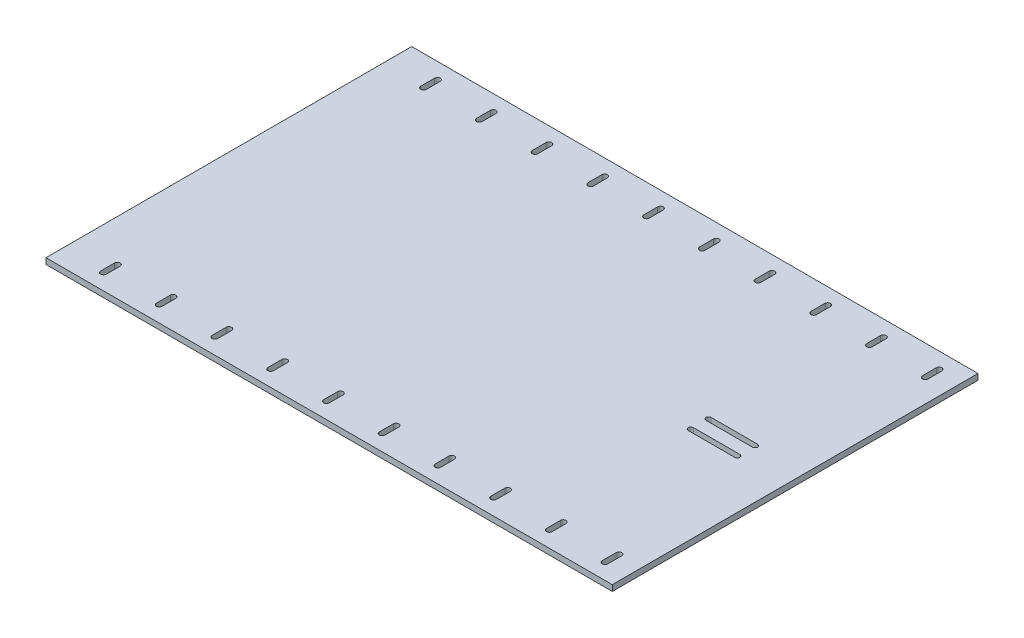
from build123d import *

# Parameters (mm, degrees)
SKETCH1_W           = 609.6
SKETCH1_H           = 393.7
BOSS_EXTRUDE1_DEPTH = 6.35


with BuildPart() as part:
    # Sketch1 → Boss-Extrude1 (new body)
    with BuildSketch(Plane(origin=(0, 0, 0), x_dir=(1, 0, 0), z_dir=(0, 1, 0))):
        with Locations((304.8, 196.85)):
            Rectangle(SKETCH1_W, SKETCH1_H)
        with BuildLine():
            Line((587.8, 32.05), (587.8, 17.05))
            ThreePointArc((587.8, 17.05), (584.8, 14.05), (581.8, 17.05))
            Line((581.8, 17.05), (581.8, 32.05))
            ThreePointArc((581.8, 32.05), (584.8, 35.05), (587.8, 32.05))
        make_face(mode=Mode.SUBTRACT)
        with BuildLine():
            Line((527.8, 32.05), (527.8, 17.05))
            ThreePointArc((527.8, 17.05), (524.8, 14.05), (521.8, 17.05))
            Line((521.8, 17.05), (521.8, 32.05))
            ThreePointArc((521.8, 32.05), (524.8, 35.05), (527.8, 32.05))
        make_face(mode=Mode.SUBTRACT)
        with BuildLine():
            Line((467.8, 32.05), (467.8, 17.05))
            ThreePointArc((467.8, 17.05), (464.8, 14.05), (461.8, 17.05))
            Line((461.8, 17.05), (461.8, 32.05))
            ThreePointArc((461.8, 32.05), (464.8, 35.05), (467.8, 32.05))
        make_face(mode=Mode.SUBTRACT)
        with BuildLine():
            Line((407.8, 32.05), (407.8, 17.05))
            ThreePointArc((407.8, 17.05), (404.8, 14.05), (401.8, 17.05))
            Line((401.8, 17.05), (401.8, 32.05))
            ThreePointArc((401.8, 32.05), (404.8, 35.05), (407.8, 32.05))
        make_face(mode=Mode.SUBTRACT)
        with BuildLine():
            Line((347.8, 32.05), (347.8, 17.05))
            ThreePointArc((347.8, 17.05), (344.8, 14.05), (341.8, 17.05))
            Line((341.8, 17.05), (341.8, 32.05))
            ThreePointArc((341.8, 32.05), (344.8, 35.05), (347.8, 32.05))
        make_face(mode=Mode.SUBTRACT)
        with BuildLine():
            Line((287.8, 32.05), (287.8, 17.05))
            ThreePointArc((287.8, 17.05), (284.8, 14.05), (281.8, 17.05))
            Line((281.8, 17.05), (281.8, 32.05))
            ThreePointArc((281.8, 32.05), (284.8, 35.05), (287.8, 32.05))
        make_face(mode=Mode.SUBTRACT)
        with BuildLine():
            Line((227.8, 32.05), (227.8, 17.05))
            ThreePointArc((227.8, 17.05), (224.8, 14.05), (221.8, 17.05))
            Line((221.8, 17.05), (221.8, 32.05))
            ThreePointArc((221.8, 32.05), (224.8, 35.05), (227.8, 32.05))
        make_face(mode=Mode.SUBTRACT)
        with BuildLine():
            Line((167.8, 32.05), (167.8, 17.05))
            ThreePointArc((167.8, 17.05), (164.8, 14.05), (161.8, 17.05))
            Line((161.8, 17.05), (161.8, 32.05))
            ThreePointArc((161.8, 32.05), (164.8, 35.05), (167.8, 32.05))
        make_face(mode=Mode.SUBTRACT)
        with BuildLine():
            Line((107.8, 32.05), (107.8, 17.05))
            ThreePointArc((107.8, 17.05), (104.8, 14.05), (101.8, 17.05))
            Line((101.8, 17.05), (101.8, 32.05))
            ThreePointArc((101.8, 32.05), (104.8, 35.05), (107.8, 32.05))
        make_face(mode=Mode.SUBTRACT)
        with BuildLine():
            Line((47.8, 32.05), (47.8, 17.05))
            ThreePointArc((47.8, 17.05), (44.8, 14.05), (41.8, 17.05))
            Line((41.8, 17.05), (41.8, 32.05))
            ThreePointArc((41.8, 32.05), (44.8, 35.05), (47.8, 32.05))
        make_face(mode=Mode.SUBTRACT)
        with BuildLine():
            Line((527.8, 376.65), (527.8, 361.65))
            ThreePointArc((527.8, 361.65), (524.8, 358.65), (521.8, 361.65))
            Line((521.8, 361.65), (521.8, 376.65))
            ThreePointArc((521.8, 376.65), (524.8, 379.65), (527.8, 376.65))
        make_face(mode=Mode.SUBTRACT)
        with BuildLine():
            Line((467.8, 376.65), (467.8, 361.65))
            ThreePointArc((467.8, 361.65), (464.8, 358.65), (461.8, 361.65))
            Line((461.8, 361.65), (461.8, 376.65))
            ThreePointArc((461.8, 376.65), (464.8, 379.65), (467.8, 376.65))
        make_face(mode=Mode.SUBTRACT)
        with BuildLine():
            Line((407.8, 376.65), (407.8, 361.65))
            ThreePointArc((407.8, 361.65), (404.8, 358.65), (401.8, 361.65))
            Line((401.8, 361.65), (401.8, 376.65))
            ThreePointArc((401.8, 376.65), (404.8, 379.65), (407.8, 376.65))
        make_face(mode=Mode.SUBTRACT)
        with BuildLine():
            Line((347.8, 376.65), (347.8, 361.65))
            ThreePointArc((347.8, 361.65), (344.8, 358.65), (341.8, 361.65))
            Line((341.8, 361.65), (341.8, 376.65))
            ThreePointArc((341.8, 376.65), (344.8, 379.65), (347.8, 376.65))
        make_face(mode=Mode.SUBTRACT)
        with BuildLine():
            Line((287.8, 376.65), (287.8, 361.65))
            ThreePointArc((287.8, 361.65), (284.8, 358.65), (281.8, 361.65))
            Line((281.8, 361.65), (281.8, 376.65))
            ThreePointArc((281.8, 376.65), (284.8, 379.65), (287.8, 376.65))
        make_face(mode=Mode.SUBTRACT)
        with BuildLine():
            Line((227.8, 376.65), (227.8, 361.65))
            ThreePointArc((227.8, 361.65), (224.8, 358.65), (221.8, 361.65))
            Line((221.8, 361.65), (221.8, 376.65))
            ThreePointArc((221.8, 376.65), (224.8, 379.65), (227.8, 376.65))
        make_face(mode=Mode.SUBTRACT)
        with BuildLine():
            Line((167.8, 376.65), (167.8, 361.65))
            ThreePointArc((167.8, 361.65), (164.8, 358.65), (161.8, 361.65))
            Line((161.8, 361.65), (161.8, 376.65))
            ThreePointArc((161.8, 376.65), (164.8, 379.65), (167.8, 376.65))
        make_face(mode=Mode.SUBTRACT)
        with BuildLine():
            Line((107.8, 376.65), (107.8, 361.65))
            ThreePointArc((107.8, 361.65), (104.8, 358.65), (101.8, 361.65))
            Line((101.8, 361.65), (101.8, 376.65))
            ThreePointArc((101.8, 376.65), (104.8, 379.65), (107.8, 376.65))
        make_face(mode=Mode.SUBTRACT)
        with BuildLine():
            Line((47.8, 376.65), (47.8, 361.65))
            ThreePointArc((47.8, 361.65), (44.8, 358.65), (41.8, 361.65))
            Line((41.8, 361.65), (41.8, 376.65))
            ThreePointArc((41.8, 376.65), (44.8, 379.65), (47.8, 376.65))
        make_face(mode=Mode.SUBTRACT)
        with BuildLine():
            Line((587.8, 376.65), (587.8, 361.65))
            ThreePointArc((587.8, 361.65), (584.8, 358.65), (581.8, 361.65))
            Line((581.8, 361.65), (581.8, 376.65))
            ThreePointArc((581.8, 376.65), (584.8, 379.65), (587.8, 376.65))
        make_face(mode=Mode.SUBTRACT)
        with BuildLine():
            Line((506.85, 209.125), (556.85, 209.125))
            ThreePointArc((556.85, 209.125), (559.6, 206.375), (556.85, 203.625))
            Line((556.85, 203.625), (506.85, 203.625))
            ThreePointArc((506.85, 203.625), (504.1, 206.375), (506.85, 209.125))
        make_face(mode=Mode.SUBTRACT)
        with BuildLine():
            Line((506.85, 190.075), (556.85, 190.075))
            ThreePointArc((556.85, 190.075), (559.6, 187.325), (556.85, 184.575))
            Line((556.85, 184.575), (506.85, 184.575))
            ThreePointArc((506.85, 184.575), (504.1, 187.325), (506.85, 190.075))
        make_face(mode=Mode.SUBTRACT)
    extrude(amount=BOSS_EXTRUDE1_DEPTH)


solid = part.part
